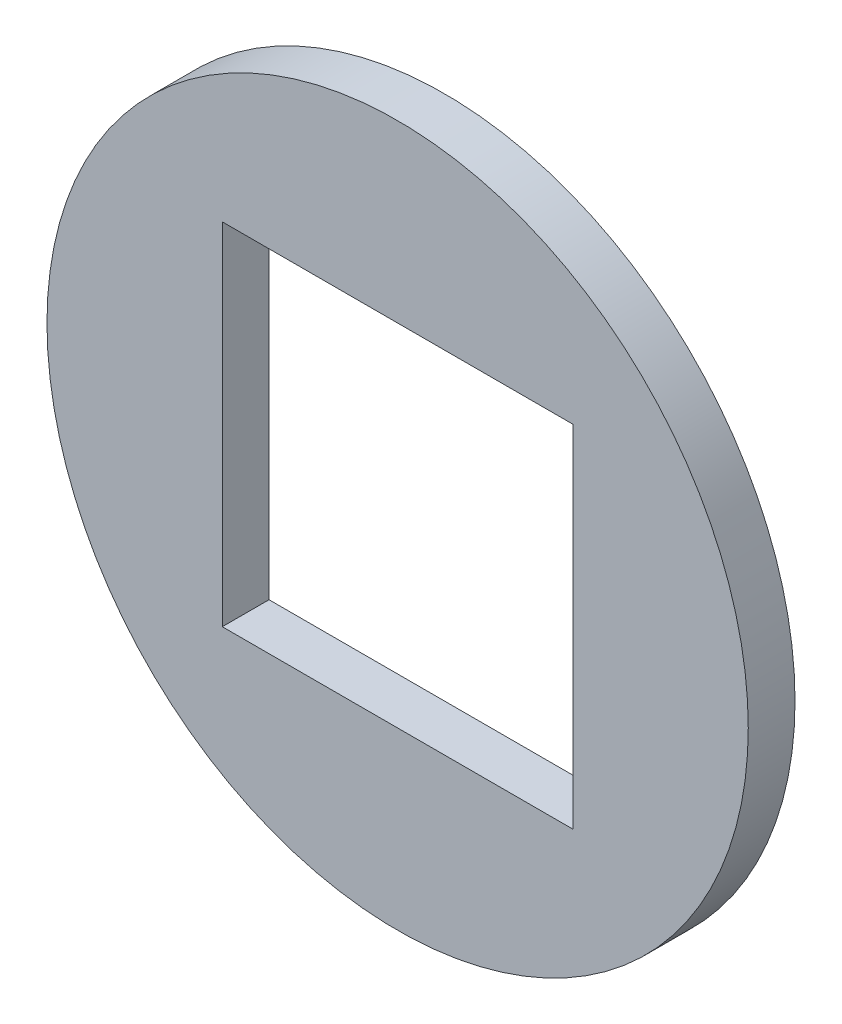
from build123d import *

# Parameters (mm, degrees)
SKETCH1_R           = 15
SKETCH1_W           = 15
SKETCH1_H           = 15
BOSS_EXTRUDE1_DEPTH = 2


with BuildPart() as part:
    # Sketch1 → Boss-Extrude1 (new body)
    with BuildSketch(Plane.XY):
        Circle(SKETCH1_R)
        Rectangle(SKETCH1_W, SKETCH1_H, mode=Mode.SUBTRACT)
    extrude(amount=BOSS_EXTRUDE1_DEPTH)


solid = part.part
